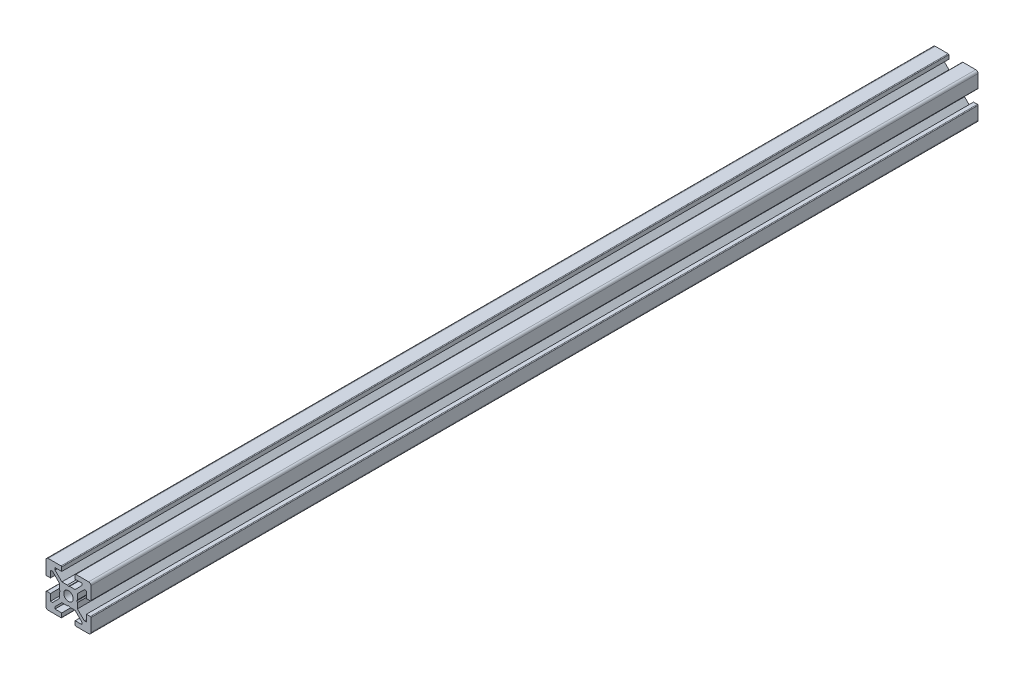
from build123d import *

# Parameters (mm, degrees)
BOSS_EXTRUDE1_DEPTH = 395
SKETCH2_W           = 400
SKETCH2_H           = 2.1


with BuildPart() as part:
    # Sketch1 → Boss-Extrude1 (new body)
    with BuildSketch(Plane.XY):
        with BuildLine():
            Line((-10, 9), (-10, 3.29999995))
            ThreePointArc((-10, 3.29999995), (-9.912132049, 3.087867916), (-9.7, 3))
            Line((-9.7, 3), (-8, 3))
            Line((-8, 3), (-8, 6))
            Line((-8, 6), (-7.060677, 6))
            Line((-7.060677, 6), (-4, 2.93932965))
            Line((-4, 2.93932965), (-4, 0.519615242))
            Line((-4, 0.519615242), (-3.699996283, -6.437e-06))
            Line((-3.699996283, -6.437e-06), (-4, -0.519628117))
            Line((-4, -0.519628117), (-4, -2.93933725))
            Line((-4, -2.93933725), (-7.0606695, -6))
            Line((-7.0606695, -6), (-8, -6))
            Line((-8, -6), (-8, -3))
            Line((-8, -3), (-9.7, -3))
            ThreePointArc((-9.7, -3), (-9.912132049, -3.087867916), (-10, -3.29999995))
            Line((-10, -3.29999995), (-10, -9))
            ThreePointArc((-10, -9), (-9.707106781, -9.707106781), (-9, -10))
            Line((-9, -10), (-3.29999995, -10))
            ThreePointArc((-3.29999995, -10), (-3.087867916, -9.912132049), (-3, -9.7))
            Line((-3, -9.7), (-3, -8))
            Line((-3, -8), (-6, -8))
            Line((-6, -8), (-6, -7.0606515))
            Line((-6, -7.0606515), (-2.9393489, -4))
            Line((-2.9393489, -4), (-0.519615242, -4))
            Line((-0.519615242, -4), (6.437e-06, -3.699996283))
            Line((6.437e-06, -3.699996283), (0.519628117, -4))
            Line((0.519628117, -4), (2.9393227, -4))
            Line((2.9393227, -4), (6, -7.060677))
            Line((6, -7.060677), (6, -8))
            Line((6, -8), (3, -8))
            Line((3, -8), (3, -9.7))
            ThreePointArc((3, -9.7), (3.087867916, -9.912132049), (3.29999995, -10))
            Line((3.29999995, -10), (9, -10))
            ThreePointArc((9, -10), (9.707106781, -9.707106781), (10, -9))
            Line((10, -9), (10, -3.29999995))
            ThreePointArc((10, -3.29999995), (9.912132049, -3.087867916), (9.7, -3))
            Line((9.7, -3), (8, -3))
            Line((8, -3), (8, -6))
            Line((8, -6), (7.0606435, -6))
            Line((7.0606435, -6), (4, -2.9393482))
            Line((4, -2.9393482), (4, -0.519615242))
            Line((4, -0.519615242), (3.699996283, 6.437e-06))
            Line((3.699996283, 6.437e-06), (4, 0.519628117))
            Line((4, 0.519628117), (4, 2.9393401))
            Line((4, 2.9393401), (7.060651, 6))
            Line((7.060651, 6), (8, 6))
            Line((8, 6), (8, 3))
            Line((8, 3), (9.7, 3))
            ThreePointArc((9.7, 3), (9.912132049, 3.087867916), (10, 3.29999995))
            Line((10, 3.29999995), (10, 9))
            ThreePointArc((10, 9), (9.707106781, 9.707106781), (9, 10))
            Line((9, 10), (3.29999995, 10))
            ThreePointArc((3.29999995, 10), (3.087867916, 9.912132049), (3, 9.7))
            Line((3, 9.7), (3, 8))
            Line((3, 8), (6, 8))
            Line((6, 8), (6, 7.060669))
            Line((6, 7.060669), (2.9393308, 4))
            Line((2.9393308, 4), (0.519615242, 4))
            Line((0.519615242, 4), (-6.437e-06, 3.699996283))
            Line((-6.437e-06, 3.699996283), (-0.519628117, 4))
            Line((-0.519628117, 4), (-2.93935655, 4))
            Line((-2.93935655, 4), (-6, 7.0606435))
            Line((-6, 7.0606435), (-6, 8))
            Line((-6, 8), (-3, 8))
            Line((-3, 8), (-3, 9.7))
            ThreePointArc((-3, 9.7), (-3.087867966, 9.912132034), (-3.3, 10))
            Line((-3.3, 10), (-9, 10))
            ThreePointArc((-9, 10), (-9.707106781, 9.707106781), (-10, 9))
        make_face()
    extrude(amount=-BOSS_EXTRUDE1_DEPTH)

    # Sketch2 → Cut-Revolve1 (revolve, cut)
    with BuildSketch(Plane(origin=(0, 0, 0), x_dir=(0, 0, -1), z_dir=(1, 0, 0)), mode=Mode.PRIVATE) as cut_revolve1_sk:
        with Locations((200, 1.05)):
            Rectangle(SKETCH2_W, SKETCH2_H)
    revolve(cut_revolve1_sk.sketch.rotate(Axis((0, 0, -400), (0, 0, 1)), 270), axis=Axis((0, 0, -400), (0, 0, 1)), mode=Mode.SUBTRACT)


solid = part.part
